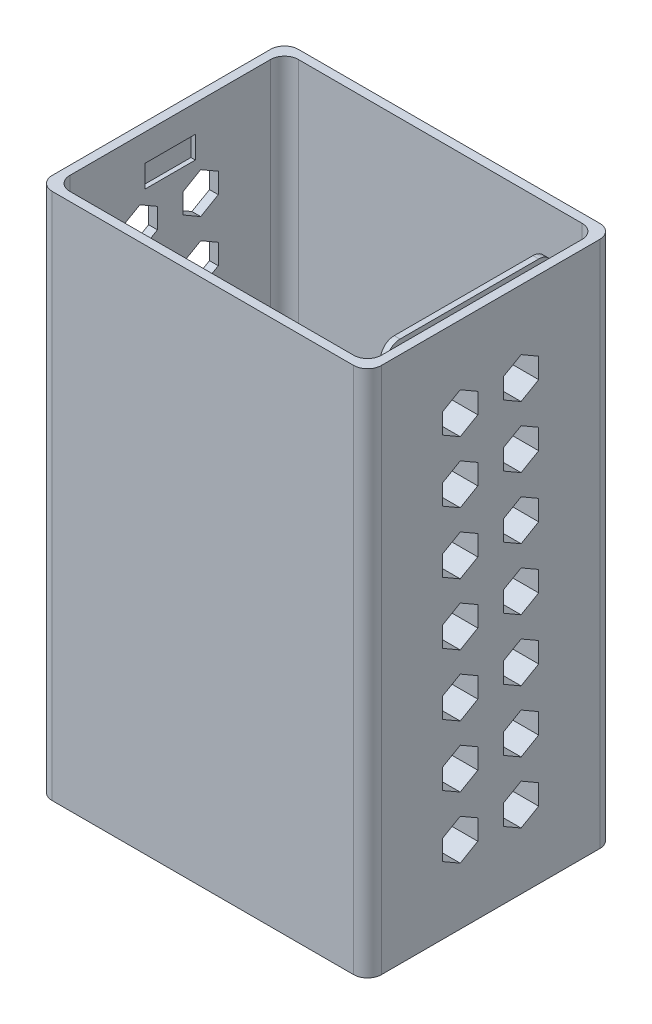
from build123d import *

# Parameters (mm, degrees)
SKETCH1_W               = 237.6932
SKETCH1_H               = 177.6984
SKETCH1_W_2             = 224.9932
SKETCH1_H_2             = 164.9984
BOSS_EXTRUDE1_DEPTH     = 374.65
SKETCH4_W               = 107.442
SKETCH4_H               = 374.65
BOSS_EXTRUDE2_DEPTH     = 9.017
SKETCH5_W               = 120.142
SKETCH5_H               = 374.65
BOSS_EXTRUDE3_DEPTH     = 4.191
SKETCH7_W               = 9.017
SKETCH7_H               = 107.442
CUT_EXTRUDE1_DEPTH      = 21.59
SKETCH10_W              = 4.191
SKETCH10_H              = 120.142
CUT_EXTRUDE2_DEPTH      = 5.588
FILLET1_R               = 10
FILLET2_R               = 10
FILLET3_R               = 10
FILLET4_R               = 10
FILLET5_R               = 10
FILLET6_R               = 10
FILLET7_R               = 10
SKETCH11_W              = 50.8
SKETCH11_H              = 15.24
BOSS_EXTRUDE4_DEPTH     = 19.9898
FILLET10_R              = 10
FILLET11_R              = 10
BOSS_EXTRUDE5_DEPTH     = 6.35
FILLET13_R              = 10
SKETCH13_W              = 36.3982
SKETCH13_H              = 16.129
CUT_EXTRUDE4_DEPTH      = 3.175
CUT_EXTRUDE5_DEPTH      = 6.35
CUT_EXTRUDE6_DEPTH      = 467.160768578
CUT_EXTRUDE6_DEPTH_BACK = 467.160768578


with BuildPart() as part:
    # Sketch1 → Boss-Extrude1 (new body)
    with BuildSketch(Plane(origin=(0, 0, 0), x_dir=(1, 0, 0), z_dir=(0, 1, 0))):
        with Locations((112.4966, -82.4992)):
            Rectangle(SKETCH1_W, SKETCH1_H)
        with Locations((112.4966, -82.4992)):
            Rectangle(SKETCH1_W_2, SKETCH1_H_2, mode=Mode.SUBTRACT)
    extrude(amount=BOSS_EXTRUDE1_DEPTH)

    # Sketch4 → Boss-Extrude2 (add)
    with BuildSketch(Plane.ZY.offset(-224.9932)):
        with Locations((82.4484, 187.325)):
            Rectangle(SKETCH4_W, SKETCH4_H)
    extrude(amount=BOSS_EXTRUDE2_DEPTH)

    # Sketch5 → Boss-Extrude3 (add)
    with BuildSketch(Plane.ZY.offset(-215.9762)):
        with Locations((82.4484, 187.325)):
            Rectangle(SKETCH5_W, SKETCH5_H)
    extrude(amount=BOSS_EXTRUDE3_DEPTH)

    # Sketch7 → Cut-Extrude1 (cut)
    with BuildSketch(Plane(origin=(0, 374.65, 0), x_dir=(1, 0, 0), z_dir=(0, 1, 0))):
        with Locations((220.4847, -82.4484)):
            Rectangle(SKETCH7_W, SKETCH7_H)
    extrude(amount=-CUT_EXTRUDE1_DEPTH, mode=Mode.SUBTRACT)

    # Sketch10 → Cut-Extrude2 (cut)
    with BuildSketch(Plane(origin=(0, 374.65, 0), x_dir=(1, 0, 0), z_dir=(0, 1, 0))):
        with Locations((213.8807, -82.4484)):
            Rectangle(SKETCH10_W, SKETCH10_H)
    extrude(amount=-CUT_EXTRUDE2_DEPTH, mode=Mode.SUBTRACT)

    # Fillet1
    fillet1_edges = [part.edges().sort_by_distance(p)[0] for p in [
        (231.3432, 187.325, 171.3484),
    ]]
    fillet(fillet1_edges, radius=FILLET1_R)

    # Fillet2
    fillet2_edges = [part.edges().sort_by_distance(p)[0] for p in [
        (224.9932, 187.325, 164.9984),
    ]]
    fillet(fillet2_edges, radius=FILLET2_R)

    # Fillet3
    fillet3_edges = [part.edges().sort_by_distance(p)[0] for p in [
        (224.9932, 187.325, 0),
        (231.3432, 187.325, -6.35),
    ]]
    fillet(fillet3_edges, radius=FILLET3_R)

    # Fillet4
    fillet4_edges = [part.edges().sort_by_distance(p)[0] for p in [
        (0, 187.325, 164.9984),
        (-6.35, 187.325, 171.3484),
    ]]
    fillet(fillet4_edges, radius=FILLET4_R)

    # Fillet5
    fillet5_edges = [part.edges().sort_by_distance(p)[0] for p in [
        (0, 187.325, 0),
        (-6.35, 187.325, -6.35),
    ]]
    fillet(fillet5_edges, radius=FILLET5_R)

    # Fillet6
    fillet6_edges = [part.edges().sort_by_distance(p)[0] for p in [
        (220.4847, 353.06, 28.7274),
        (220.4847, 353.06, 136.1694),
    ]]
    fillet(fillet6_edges, radius=FILLET6_R)

    # Fillet7
    fillet7_edges = [part.edges().sort_by_distance(p)[0] for p in [
        (213.8807, 369.062, 22.3774),
        (213.8807, 369.062, 142.5194),
    ]]
    fillet(fillet7_edges, radius=FILLET7_R)

    # Sketch11 → Boss-Extrude4 (add)
    with BuildSketch(Plane.ZY.offset(-211.7852)):
        with Locations((82.4484, 7.62)):
            Rectangle(SKETCH11_W, SKETCH11_H)
    extrude(amount=BOSS_EXTRUDE4_DEPTH)

    # Fillet10
    fillet10_edges = [part.edges().sort_by_distance(p)[0] for p in [
        (191.7954, 7.62, 57.0484),
        (191.7954, 7.62, 107.8484),
    ]]
    fillet(fillet10_edges, radius=FILLET10_R)

    # Fillet11
    fillet11_edges = [part.edges().sort_by_distance(p)[0] for p in [
        (191.7954, 15.24, 82.4484),
        (206.7903, 15.24, 57.0484),
        (206.7903, 15.24, 107.8484),
        (194.724332188, 15.24, 59.977332188),
        (194.724332188, 15.24, 104.919467812),
    ]]
    fillet(fillet11_edges, radius=FILLET11_R)

    # Sketch12 → Boss-Extrude5 (add)
    with BuildSketch(Plane.XZ):
        with BuildLine():
            Line((231.3432, 161.3484), (231.3432, 3.65))
            ThreePointArc((231.3432, 3.65), (228.414267812, -3.421067812), (221.3432, -6.35))
            Line((221.3432, -6.35), (3.65, -6.35))
            ThreePointArc((3.65, -6.35), (-3.421067812, -3.421067812), (-6.35, 3.65))
            Line((-6.35, 3.65), (-6.35, 161.3484))
            ThreePointArc((-6.35, 161.3484), (-3.421067812, 168.419467812), (3.65, 171.3484))
            Line((3.65, 171.3484), (221.3432, 171.3484))
            ThreePointArc((221.3432, 171.3484), (228.414267812, 168.419467812), (231.3432, 161.3484))
        make_face()
    extrude(amount=BOSS_EXTRUDE5_DEPTH)

    # Fillet13
    fillet13_edges = [part.edges().sort_by_distance(p)[0] for p in [
        (224.9932, 0, 19.3637),
        (222.064267812, 0, 2.928932188),
        (112.4966, 0, 0),
        (2.928932188, 0, 2.928932188),
        (224.9932, 0, 145.5839),
        (222.064267812, 0, 162.069467812),
        (112.4966, 0, 164.9984),
        (2.928932188, 0, 162.069467812),
        (0, 0, 82.4992),
    ]]
    fillet(fillet13_edges, radius=FILLET13_R)

    # Sketch13 → Cut-Extrude4 (cut)
    with BuildSketch(Plane(origin=(0, 0, 0), x_dir=(0, 0, -1), z_dir=(1, 0, 0))):
        with Locations((-82.5551, 346.9767)):
            Rectangle(SKETCH13_W, SKETCH13_H)
    extrude(amount=-CUT_EXTRUDE4_DEPTH, mode=Mode.SUBTRACT)

    # Sketch15 → Cut-Extrude5 (cut)
    with BuildSketch(Plane.XZ.offset(6.35)):
        Polygon((177.8, 131.139877372), (184.15, 134.806051581), (184.15, 142.1384), (177.8, 145.80457421), (171.45, 142.1384), (171.45, 134.806051581), align=None)
        Polygon((196.85, 131.139877372), (203.2, 134.806051581), (203.2, 142.1384), (196.85, 145.80457421), (190.5, 142.1384), (190.5, 134.806051581), align=None)
        Polygon((158.75, 131.139877372), (165.1, 134.806051581), (165.1, 142.1384), (158.75, 145.80457421), (152.4, 142.1384), (152.4, 134.806051581), align=None)
        Polygon((139.7, 131.139877372), (146.05, 134.806051581), (146.05, 142.1384), (139.7, 145.80457421), (133.35, 142.1384), (133.35, 134.806051581), align=None)
        Polygon((120.65, 131.139877372), (127, 134.806051581), (127, 142.1384), (120.65, 145.80457421), (114.3, 142.1384), (114.3, 134.806051581), align=None)
        Polygon((101.6, 131.139877372), (107.95, 134.806051581), (107.95, 142.1384), (101.6, 145.80457421), (95.25, 142.1384), (95.25, 134.806051581), align=None)
        Polygon((82.55, 131.139877372), (88.9, 134.806051581), (88.9, 142.1384), (82.55, 145.80457421), (76.2, 142.1384), (76.2, 134.806051581), align=None)
        Polygon((63.5, 131.139877372), (69.85, 134.806051581), (69.85, 142.1384), (63.5, 145.80457421), (57.15, 142.1384), (57.15, 134.806051581), align=None)
        Polygon((44.45, 131.139877372), (50.8, 134.806051581), (50.8, 142.1384), (44.45, 145.80457421), (38.1, 142.1384), (38.1, 134.806051581), align=None)
        Polygon((25.4, 131.139877372), (31.75, 134.806051581), (31.75, 142.1384), (25.4, 145.80457421), (19.05, 142.1384), (19.05, 134.806051581), align=None)
        Polygon((32.471566581, 113.225602985), (38.821566581, 116.891777194), (38.821566581, 124.224125613), (32.471566581, 127.890299822), (26.121566581, 124.224125613), (26.121566581, 116.891777194), align=None)
        Polygon((51.521566581, 113.225602985), (57.871566581, 116.891777194), (57.871566581, 124.224125613), (51.521566581, 127.890299822), (45.171566581, 124.224125613), (45.171566581, 116.891777194), align=None)
        Polygon((70.571566581, 113.225602985), (76.921566581, 116.891777194), (76.921566581, 124.224125613), (70.571566581, 127.890299822), (64.221566581, 124.224125613), (64.221566581, 116.891777194), align=None)
        Polygon((89.621566581, 113.225602985), (95.971566581, 116.891777194), (95.971566581, 124.224125613), (89.621566581, 127.890299822), (83.271566581, 124.224125613), (83.271566581, 116.891777194), align=None)
        Polygon((108.671566581, 113.225602985), (115.021566581, 116.891777194), (115.021566581, 124.224125613), (108.671566581, 127.890299822), (102.321566581, 124.224125613), (102.321566581, 116.891777194), align=None)
        Polygon((127.721566581, 113.225602985), (134.071566581, 116.891777194), (134.071566581, 124.224125613), (127.721566581, 127.890299822), (121.371566581, 124.224125613), (121.371566581, 116.891777194), align=None)
        Polygon((146.771566581, 113.225602985), (153.121566581, 116.891777194), (153.121566581, 124.224125613), (146.771566581, 127.890299822), (140.421566581, 124.224125613), (140.421566581, 116.891777194), align=None)
        Polygon((165.821566581, 113.225602985), (172.171566581, 116.891777194), (172.171566581, 124.224125613), (165.821566581, 127.890299822), (159.471566581, 124.224125613), (159.471566581, 116.891777194), align=None)
        Polygon((184.871566581, 113.225602985), (191.221566581, 116.891777194), (191.221566581, 124.224125613), (184.871566581, 127.890299822), (178.521566581, 124.224125613), (178.521566581, 116.891777194), align=None)
        Polygon((25.4, 95.311328598), (31.75, 98.977502807), (31.75, 106.309851226), (25.4, 109.976025435), (19.05, 106.309851226), (19.05, 98.977502807), align=None)
        Polygon((44.45, 95.311328598), (50.8, 98.977502807), (50.8, 106.309851226), (44.45, 109.976025435), (38.1, 106.309851226), (38.1, 98.977502807), align=None)
        Polygon((63.5, 95.311328598), (69.85, 98.977502807), (69.85, 106.309851226), (63.5, 109.976025435), (57.15, 106.309851226), (57.15, 98.977502807), align=None)
        Polygon((82.55, 95.311328598), (88.9, 98.977502807), (88.9, 106.309851226), (82.55, 109.976025435), (76.2, 106.309851226), (76.2, 98.977502807), align=None)
        Polygon((101.6, 95.311328598), (107.95, 98.977502807), (107.95, 106.309851226), (101.6, 109.976025435), (95.25, 106.309851226), (95.25, 98.977502807), align=None)
        Polygon((120.65, 95.311328598), (127, 98.977502807), (127, 106.309851226), (120.65, 109.976025435), (114.3, 106.309851226), (114.3, 98.977502807), align=None)
        Polygon((139.7, 95.311328598), (146.05, 98.977502807), (146.05, 106.309851226), (139.7, 109.976025435), (133.35, 106.309851226), (133.35, 98.977502807), align=None)
        Polygon((158.75, 95.311328598), (165.1, 98.977502807), (165.1, 106.309851226), (158.75, 109.976025435), (152.4, 106.309851226), (152.4, 98.977502807), align=None)
        Polygon((177.8, 95.311328598), (184.15, 98.977502807), (184.15, 106.309851226), (177.8, 109.976025435), (171.45, 106.309851226), (171.45, 98.977502807), align=None)
        Polygon((184.871566581, 77.397054211), (191.221566581, 81.06322842), (191.221566581, 88.395576839), (184.871566581, 92.061751048), (178.521566581, 88.395576839), (178.521566581, 81.06322842), align=None)
        Polygon((165.821566581, 77.397054211), (172.171566581, 81.06322842), (172.171566581, 88.395576839), (165.821566581, 92.061751048), (159.471566581, 88.395576839), (159.471566581, 81.06322842), align=None)
        Polygon((146.771566581, 77.397054211), (153.121566581, 81.06322842), (153.121566581, 88.395576839), (146.771566581, 92.061751048), (140.421566581, 88.395576839), (140.421566581, 81.06322842), align=None)
        Polygon((127.721566581, 77.397054211), (134.071566581, 81.06322842), (134.071566581, 88.395576839), (127.721566581, 92.061751048), (121.371566581, 88.395576839), (121.371566581, 81.06322842), align=None)
        Polygon((108.671566581, 77.397054211), (115.021566581, 81.06322842), (115.021566581, 88.395576839), (108.671566581, 92.061751048), (102.321566581, 88.395576839), (102.321566581, 81.06322842), align=None)
        Polygon((89.621566581, 77.397054211), (95.971566581, 81.06322842), (95.971566581, 88.395576839), (89.621566581, 92.061751048), (83.271566581, 88.395576839), (83.271566581, 81.06322842), align=None)
        Polygon((70.571566581, 77.397054211), (76.921566581, 81.06322842), (76.921566581, 88.395576839), (70.571566581, 92.061751048), (64.221566581, 88.395576839), (64.221566581, 81.06322842), align=None)
        Polygon((51.521566581, 77.397054211), (57.871566581, 81.06322842), (57.871566581, 88.395576839), (51.521566581, 92.061751048), (45.171566581, 88.395576839), (45.171566581, 81.06322842), align=None)
        Polygon((32.471566581, 77.397054211), (38.821566581, 81.06322842), (38.821566581, 88.395576839), (32.471566581, 92.061751048), (26.121566581, 88.395576839), (26.121566581, 81.06322842), align=None)
        Polygon((25.4, 59.482779824), (31.75, 63.148954033), (31.75, 70.481302452), (25.4, 74.147476661), (19.05, 70.481302452), (19.05, 63.148954033), align=None)
        Polygon((44.45, 59.482779824), (50.8, 63.148954033), (50.8, 70.481302452), (44.45, 74.147476661), (38.1, 70.481302452), (38.1, 63.148954033), align=None)
        Polygon((63.5, 59.482779824), (69.85, 63.148954033), (69.85, 70.481302452), (63.5, 74.147476661), (57.15, 70.481302452), (57.15, 63.148954033), align=None)
        Polygon((82.55, 59.482779824), (88.9, 63.148954033), (88.9, 70.481302452), (82.55, 74.147476661), (76.2, 70.481302452), (76.2, 63.148954033), align=None)
        Polygon((101.6, 59.482779824), (107.95, 63.148954033), (107.95, 70.481302452), (101.6, 74.147476661), (95.25, 70.481302452), (95.25, 63.148954033), align=None)
        Polygon((120.65, 59.482779824), (127, 63.148954033), (127, 70.481302452), (120.65, 74.147476661), (114.3, 70.481302452), (114.3, 63.148954033), align=None)
        Polygon((139.7, 59.482779824), (146.05, 63.148954033), (146.05, 70.481302452), (139.7, 74.147476661), (133.35, 70.481302452), (133.35, 63.148954033), align=None)
        Polygon((158.75, 59.482779824), (165.1, 63.148954033), (165.1, 70.481302452), (158.75, 74.147476661), (152.4, 70.481302452), (152.4, 63.148954033), align=None)
        Polygon((177.8, 59.482779824), (184.15, 63.148954033), (184.15, 70.481302452), (177.8, 74.147476661), (171.45, 70.481302452), (171.45, 63.148954033), align=None)
        Polygon((184.871566581, 41.568505436), (191.221566581, 45.234679646), (191.221566581, 52.567028064), (184.871566581, 56.233202274), (178.521566581, 52.567028064), (178.521566581, 45.234679646), align=None)
        Polygon((165.821566581, 41.568505436), (172.171566581, 45.234679646), (172.171566581, 52.567028064), (165.821566581, 56.233202274), (159.471566581, 52.567028064), (159.471566581, 45.234679646), align=None)
        Polygon((146.771566581, 41.568505436), (153.121566581, 45.234679646), (153.121566581, 52.567028064), (146.771566581, 56.233202274), (140.421566581, 52.567028064), (140.421566581, 45.234679646), align=None)
        Polygon((127.721566581, 41.568505436), (134.071566581, 45.234679646), (134.071566581, 52.567028064), (127.721566581, 56.233202274), (121.371566581, 52.567028064), (121.371566581, 45.234679646), align=None)
        Polygon((108.671566581, 41.568505436), (115.021566581, 45.234679646), (115.021566581, 52.567028064), (108.671566581, 56.233202274), (102.321566581, 52.567028064), (102.321566581, 45.234679646), align=None)
        Polygon((89.621566581, 41.568505436), (95.971566581, 45.234679646), (95.971566581, 52.567028064), (89.621566581, 56.233202274), (83.271566581, 52.567028064), (83.271566581, 45.234679646), align=None)
        Polygon((70.571566581, 41.568505436), (76.921566581, 45.234679646), (76.921566581, 52.567028064), (70.571566581, 56.233202274), (64.221566581, 52.567028064), (64.221566581, 45.234679646), align=None)
        Polygon((51.521566581, 41.568505436), (57.871566581, 45.234679646), (57.871566581, 52.567028064), (51.521566581, 56.233202274), (45.171566581, 52.567028064), (45.171566581, 45.234679646), align=None)
        Polygon((32.471566581, 41.568505436), (38.821566581, 45.234679646), (38.821566581, 52.567028064), (32.471566581, 56.233202274), (26.121566581, 52.567028064), (26.121566581, 45.234679646), align=None)
        Polygon((25.4, 23.654231049), (31.75, 27.320405259), (31.75, 34.652753677), (25.4, 38.318927887), (19.05, 34.652753677), (19.05, 27.320405259), align=None)
        Polygon((44.45, 23.654231049), (50.8, 27.320405259), (50.8, 34.652753677), (44.45, 38.318927887), (38.1, 34.652753677), (38.1, 27.320405259), align=None)
        Polygon((63.5, 23.654231049), (69.85, 27.320405259), (69.85, 34.652753677), (63.5, 38.318927887), (57.15, 34.652753677), (57.15, 27.320405259), align=None)
        Polygon((82.55, 23.654231049), (88.9, 27.320405259), (88.9, 34.652753677), (82.55, 38.318927887), (76.2, 34.652753677), (76.2, 27.320405259), align=None)
        Polygon((101.6, 23.654231049), (107.95, 27.320405259), (107.95, 34.652753677), (101.6, 38.318927887), (95.25, 34.652753677), (95.25, 27.320405259), align=None)
        Polygon((120.65, 23.654231049), (127, 27.320405259), (127, 34.652753677), (120.65, 38.318927887), (114.3, 34.652753677), (114.3, 27.320405259), align=None)
        Polygon((139.7, 23.654231049), (146.05, 27.320405259), (146.05, 34.652753677), (139.7, 38.318927887), (133.35, 34.652753677), (133.35, 27.320405259), align=None)
        Polygon((158.75, 23.654231049), (165.1, 27.320405259), (165.1, 34.652753677), (158.75, 38.318927887), (152.4, 34.652753677), (152.4, 27.320405259), align=None)
        Polygon((177.8, 23.654231049), (184.15, 27.320405259), (184.15, 34.652753677), (177.8, 38.318927887), (171.45, 34.652753677), (171.45, 27.320405259), align=None)
        Polygon((196.85, 23.654231049), (203.2, 27.320405259), (203.2, 34.652753677), (196.85, 38.318927887), (190.5, 34.652753677), (190.5, 27.320405259), align=None)
    extrude(amount=-CUT_EXTRUDE5_DEPTH, mode=Mode.SUBTRACT)

    # Sketch18 → Cut-Extrude6 (cut, two sides: drawn at the far end of the back side and taken through both)
    with BuildSketch(Plane.ZY.offset(-211.7852).offset(-CUT_EXTRUDE6_DEPTH_BACK)):
        Polygon((73.1774, 323.629651581), (60.4774, 330.962), (47.7774, 323.629651581), (47.7774, 308.964954744), (60.4774, 301.632606325), (73.1774, 308.964954744), align=None)
        Polygon((117.1194, 323.629651581), (104.4194, 330.962), (91.7194, 323.629651581), (91.7194, 308.964954744), (104.4194, 301.632606325), (117.1194, 308.964954744), align=None)
        Polygon((73.1774, 279.179651581), (60.4774, 286.512), (47.7774, 279.179651581), (47.7774, 264.514954744), (60.4774, 257.182606325), (73.1774, 264.514954744), align=None)
        Polygon((73.1774, 234.729651581), (60.4774, 242.062), (47.7774, 234.729651581), (47.7774, 220.064954744), (60.4774, 212.732606325), (73.1774, 220.064954744), align=None)
        Polygon((73.1774, 190.279651581), (60.4774, 197.612), (47.7774, 190.279651581), (47.7774, 175.614954744), (60.4774, 168.282606325), (73.1774, 175.614954744), align=None)
        Polygon((73.1774, 145.829651581), (60.4774, 153.162), (47.7774, 145.829651581), (47.7774, 131.164954744), (60.4774, 123.832606325), (73.1774, 131.164954744), align=None)
        Polygon((73.1774, 101.379651581), (60.4774, 108.712), (47.7774, 101.379651581), (47.7774, 86.714954744), (60.4774, 79.382606325), (73.1774, 86.714954744), align=None)
        Polygon((73.1774, 56.929651581), (60.4774, 64.262), (47.7774, 56.929651581), (47.7774, 42.264954744), (60.4774, 34.932606325), (73.1774, 42.264954744), align=None)
        Polygon((117.1194, 279.179651581), (104.4194, 286.512), (91.7194, 279.179651581), (91.7194, 264.514954744), (104.4194, 257.182606325), (117.1194, 264.514954744), align=None)
        Polygon((117.1194, 234.729651581), (104.4194, 242.062), (91.7194, 234.729651581), (91.7194, 220.064954744), (104.4194, 212.732606325), (117.1194, 220.064954744), align=None)
        Polygon((117.1194, 190.279651581), (104.4194, 197.612), (91.7194, 190.279651581), (91.7194, 175.614954744), (104.4194, 168.282606325), (117.1194, 175.614954744), align=None)
        Polygon((117.1194, 145.829651581), (104.4194, 153.162), (91.7194, 145.829651581), (91.7194, 131.164954744), (104.4194, 123.832606325), (117.1194, 131.164954744), align=None)
        Polygon((117.1194, 101.379651581), (104.4194, 108.712), (91.7194, 101.379651581), (91.7194, 86.714954744), (104.4194, 79.382606325), (117.1194, 86.714954744), align=None)
        Polygon((117.1194, 56.929651581), (104.4194, 64.262), (91.7194, 56.929651581), (91.7194, 42.264954744), (104.4194, 34.932606325), (117.1194, 42.264954744), align=None)
    extrude(amount=CUT_EXTRUDE6_DEPTH + CUT_EXTRUDE6_DEPTH_BACK, mode=Mode.SUBTRACT)


solid = part.part
